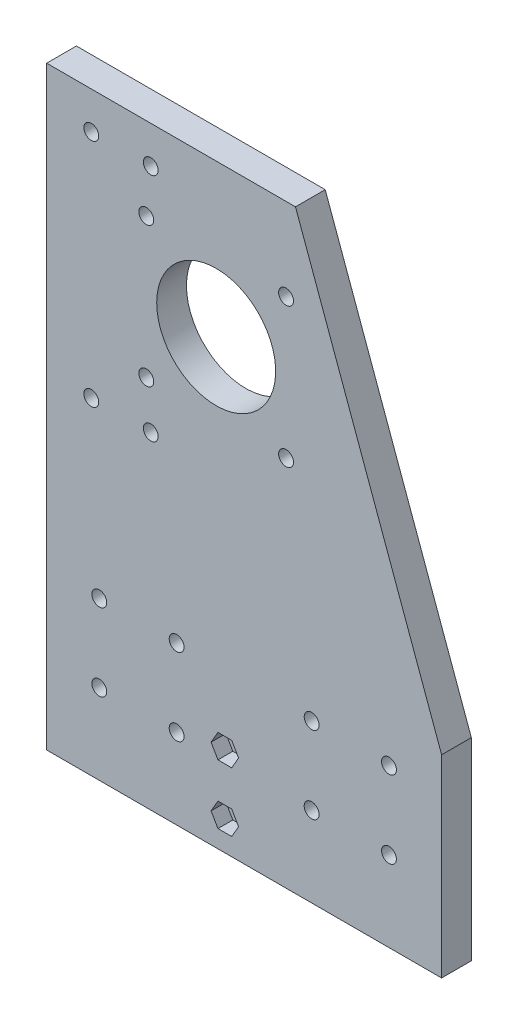
from build123d import *

# Parameters (mm, degrees)
SKETCH1_R           = 2.5
BOSS_EXTRUDE1_DEPTH = 10
CUT_EXTRUDE1_START  = 5
SKETCH1_3_R         = 2.5
CUT_EXTRUDE1_DEPTH  = 5
SKETCH4_R           = 2.5
SKETCH4_R_2         = 20
CUT_EXTRUDE2_DEPTH  = 241.282833344


with BuildPart() as part:
    # Sketch1 → Boss-Extrude1 (new body)
    with BuildSketch(Plane.XY):
        Polygon((0, 200), (0, 0), (132.8, 0), (132.8, 65), (83.664018374, 200), align=None)
        with Locations((17.7, 27)):
            Circle(SKETCH1_R, mode=Mode.SUBTRACT)
        with Locations((43.7, 27)):
            Circle(SKETCH1_R, mode=Mode.SUBTRACT)
        with Locations((17.7, 53)):
            Circle(SKETCH1_R, mode=Mode.SUBTRACT)
        with Locations((43.7, 53)):
            Circle(SKETCH1_R, mode=Mode.SUBTRACT)
        with Locations((89.1, 27)):
            Circle(SKETCH1_R, mode=Mode.SUBTRACT)
        with Locations((115.1, 27)):
            Circle(SKETCH1_R, mode=Mode.SUBTRACT)
        with Locations((89.1, 53)):
            Circle(SKETCH1_R, mode=Mode.SUBTRACT)
        with Locations((115.1, 53)):
            Circle(SKETCH1_R, mode=Mode.SUBTRACT)
        with Locations((59.91, 9.92)):
            Circle(SKETCH1_R, mode=Mode.SUBTRACT)
        with Locations((59.91, 29.92)):
            Circle(SKETCH1_R, mode=Mode.SUBTRACT)
    extrude(amount=BOSS_EXTRUDE1_DEPTH)

    # Sketch1<3> → Cut-Extrude1 (cut)
    # profile 1 of 2: a face of its own
    with BuildSketch(Plane.XY.offset(CUT_EXTRUDE1_START)):
        Polygon((62.2225, 25.914632507), (64.535, 29.92), (62.2225, 33.925367493), (57.5975, 33.925367493), (55.285, 29.92), (57.5975, 25.914632507), align=None)
        with Locations((59.91, 29.92)):
            Circle(SKETCH1_3_R, mode=Mode.SUBTRACT)
    # profile 2 of 2: a face of its own
    with BuildSketch(Plane.XY.offset(CUT_EXTRUDE1_START)):
        Polygon((64.535, 9.92), (62.2225, 13.925367493), (57.5975, 13.925367493), (55.285, 9.92), (57.5975, 5.914632507), (62.2225, 5.914632507), align=None)
        with Locations((59.91, 9.92)):
            Circle(SKETCH1_3_R, mode=Mode.SUBTRACT)
    extrude(amount=CUT_EXTRUDE1_DEPTH, mode=Mode.SUBTRACT)

    # Sketch4 → Cut-Extrude2 (cut, through all)
    with BuildSketch(Plane(origin=(0, 0, 0), x_dir=(-1, 0, 0), z_dir=(0, 0, -1))):
        with Locations((-15, 187.5)):
            Circle(SKETCH4_R)
        with Locations((-35, 187.5)):
            Circle(SKETCH4_R)
        with Locations((-35, 110)):
            Circle(SKETCH4_R)
        with Locations((-15, 110)):
            Circle(SKETCH4_R)
        with Locations((-57, 148.75)):
            Circle(SKETCH4_R_2)
        with Locations((-33.5, 172.25)):
            Circle(SKETCH4_R)
        with Locations((-33.5, 125.25)):
            Circle(SKETCH4_R)
        with Locations((-80.5, 125.25)):
            Circle(SKETCH4_R)
        with Locations((-80.5, 172.25)):
            Circle(SKETCH4_R)
    extrude(amount=-CUT_EXTRUDE2_DEPTH, mode=Mode.SUBTRACT)


solid = part.part
